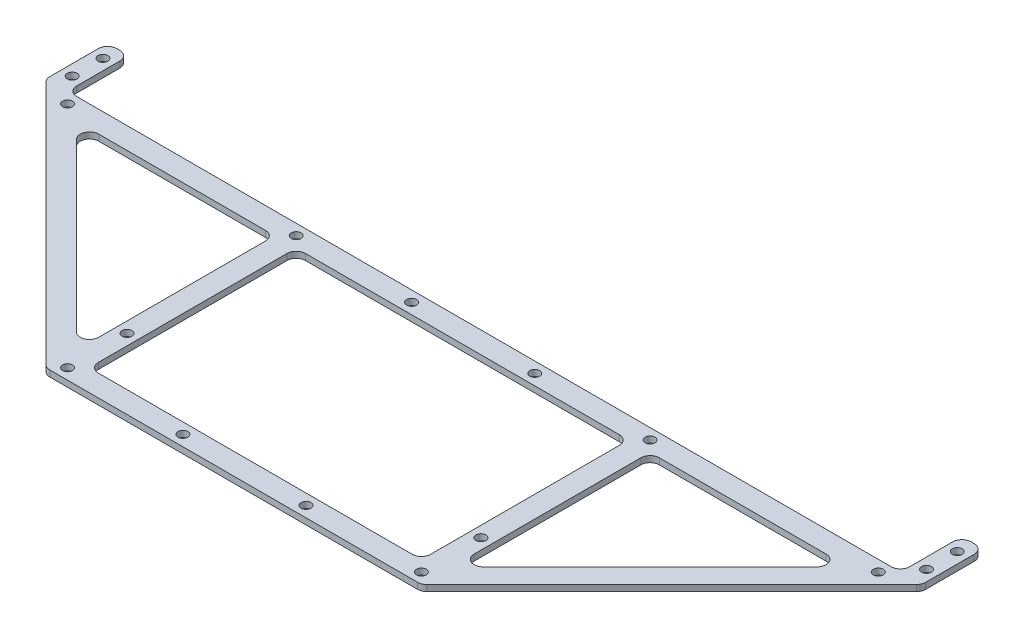
from build123d import *

# Parameters (mm, degrees)
SKETCH_1_R      = 1.6
SKETCH_1_W      = 108
SKETCH_1_H      = 67.317279836
EXTRUDE_1_DEPTH = 2
FILLET_1_R      = 3


with BuildPart() as part:
    # ｽｹｯﾁ1 → ﾎﾞｽ - 押し出し1 (new body)
    with BuildSketch(Plane(origin=(0, 0, 0), x_dir=(1, 0, 0), z_dir=(0, 1, 0))):
        Polygon((-61, 40.658639918), (-135.317279836, 40.658639918), (-135.317279836, 60.658639918), (-142.317279836, 60.658639918), (-142.317279836, 40.658639918), (-61, -40.658639918), (61, -40.658639918), (142.317279836, 40.658639918), (142.317279836, 60.658639918), (135.317279836, 60.658639918), (135.317279836, 40.658639918), (61, 40.658639918), align=None)
        with Locations(Location((-57.5, -37.158639918, 0), (0, 0, 270))):
            Circle(SKETCH_1_R, mode=Mode.SUBTRACT)
        with Locations(Location((57.5, -37.158639918, 0), (0, 0, 270))):
            Circle(SKETCH_1_R, mode=Mode.SUBTRACT)
        with Locations(Location((-131.746212025, 37.087572106, 0), (0, 0, 270))):
            Circle(SKETCH_1_R, mode=Mode.SUBTRACT)
        with Locations(Location((131.746212025, 37.087572106, 0), (0, 0, 270))):
            Circle(SKETCH_1_R, mode=Mode.SUBTRACT)
        with Locations(Location((20, -37.158639918, 0), (0, 0, 270))):
            Circle(SKETCH_1_R, mode=Mode.SUBTRACT)
        with Locations(Location((-20, -37.158639918, 0), (0, 0, 270))):
            Circle(SKETCH_1_R, mode=Mode.SUBTRACT)
        with Locations(Location((20, 37.158639918, 0), (0, 0, 90))):
            Circle(SKETCH_1_R, mode=Mode.SUBTRACT)
        with Locations(Location((-20, 37.158639918, 0), (0, 0, 90))):
            Circle(SKETCH_1_R, mode=Mode.SUBTRACT)
        with Locations(Location((57.5, 37.158639918, 0), (0, 0, 270))):
            Circle(SKETCH_1_R, mode=Mode.SUBTRACT)
        with Locations(Location((57.5, -17.841360082, 0), (0, 0, 270))):
            Circle(SKETCH_1_R, mode=Mode.SUBTRACT)
        with Locations(Location((-57.5, -17.841360082, 0), (0, 0, 90))):
            Circle(SKETCH_1_R, mode=Mode.SUBTRACT)
        with Locations(Location((-57.5, 37.158639918, 0), (0, 0, 90))):
            Circle(SKETCH_1_R, mode=Mode.SUBTRACT)
        with Locations(Location((138.817279836, 55.658639918, 0), (0, 0, 270))):
            Circle(SKETCH_1_R, mode=Mode.SUBTRACT)
        with Locations(Location((138.817279836, 45.658639918, 0), (0, 0, 270))):
            Circle(SKETCH_1_R, mode=Mode.SUBTRACT)
        with Locations(Location((-138.817279836, 55.658639918, 0), (0, 0, 270))):
            Circle(SKETCH_1_R, mode=Mode.SUBTRACT)
        with Locations(Location((-138.817279836, 45.658639918, 0), (0, 0, 270))):
            Circle(SKETCH_1_R, mode=Mode.SUBTRACT)
        Rectangle(SKETCH_1_W, SKETCH_1_H, mode=Mode.SUBTRACT)
        Polygon((-125.4177849, 33.658639918), (-61, -30.759144982), (-61, 33.658639918), align=None, mode=Mode.SUBTRACT)
        Polygon((61, 33.658639918), (61, -30.759144982), (125.4177849, 33.658639918), align=None, mode=Mode.SUBTRACT)
    extrude(amount=EXTRUDE_1_DEPTH)

    # ﾌｨﾚｯﾄ1
    fillet_1_edges = [part.edges().sort_by_distance(p)[0] for p in [
        (135.317279836, 1, -40.658639918),
        (135.317279836, 1, -60.658639918),
        (142.317279836, 1, -60.658639918),
        (142.317279836, 1, -40.658639918),
        (61, 1, 40.658639918),
        (-61, 1, 40.658639918),
        (-142.317279836, 1, -40.658639918),
        (-142.317279836, 1, -60.658639918),
        (-135.317279836, 1, -60.658639918),
        (-135.317279836, 1, -40.658639918),
        (-54, 1, -33.658639918),
        (-54, 1, 33.658639918),
        (54, 1, 33.658639918),
        (54, 1, -33.658639918),
        (-61, 1, -33.658639918),
        (-125.4177849, 1, -33.658639918),
        (-61, 1, 30.759144982),
        (125.4177849, 1, -33.658639918),
        (61, 1, -33.658639918),
        (61, 1, 30.759144982),
    ]]
    fillet(fillet_1_edges, radius=FILLET_1_R)


solid = part.part
